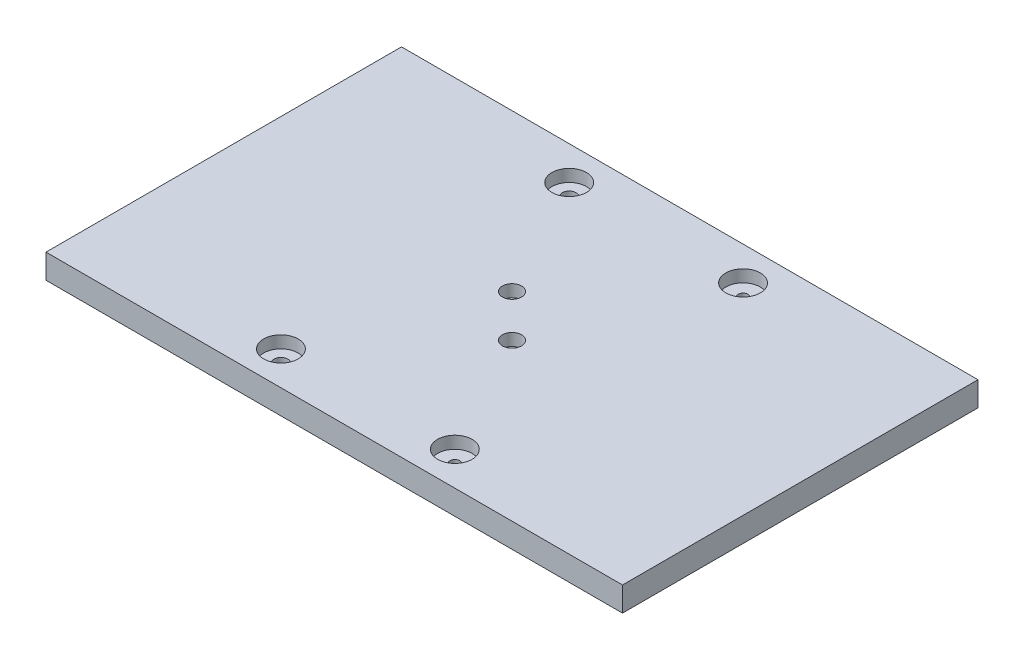
from build123d import *

# Parameters (mm, degrees)
SKETCH1_W           = 300
SKETCH1_H           = 185
SKETCH1_R           = 3.56
SKETCH1_R_2         = 2.5
BOSS_EXTRUDE1_DEPTH = 12.7
CUT_EXTRUDE1_START  = -6.35
SKETCH2_R           = 9
SKETCH2_R_2         = 3.56
SKETCH2_R_3         = 2.5
SKETCH2_R_4         = 5
CUT_EXTRUDE1_DEPTH  = 6.35


with BuildPart() as part:
    # Sketch1 → Boss-Extrude1 (new body)
    with BuildSketch(Plane(origin=(0, 0, 0), x_dir=(1, 0, 0), z_dir=(0, 1, 0))):
        Rectangle(SKETCH1_W, SKETCH1_H)
        with Locations(Location((-45.25, 75, 0), (0, 0, 270))):
            Circle(SKETCH1_R, mode=Mode.SUBTRACT)
        with Locations(Location((-45.25, -75, 0), (0, 0, 270))):
            Circle(SKETCH1_R, mode=Mode.SUBTRACT)
        with Locations(Location((45.25, 75, 0), (0, 0, 270))):
            Circle(SKETCH1_R_2, mode=Mode.SUBTRACT)
        with Locations(Location((45.25, -75, 0), (0, 0, 270))):
            Circle(SKETCH1_R_2, mode=Mode.SUBTRACT)
        with Locations(Location((-11, 11, 0), (0, 0, 270))):
            Circle(SKETCH1_R_2, mode=Mode.SUBTRACT)
        with Locations(Location((11, -11, 0), (0, 0, 270))):
            Circle(SKETCH1_R_2, mode=Mode.SUBTRACT)
    extrude(amount=BOSS_EXTRUDE1_DEPTH)

    # Sketch2 → Cut-Extrude1 (cut)
    # profile 1 of 6: a face of its own
    with BuildSketch(Plane(origin=(0, 12.7, 0), x_dir=(1, 0, 0), z_dir=(0, 1, 0)).offset(CUT_EXTRUDE1_START)):
        with Locations(Location((-45.25, 75, 0), (0, 0, 270))):
            Circle(SKETCH2_R)
        with Locations(Location((-45.25, 75, 0), (0, 0, 270))):
            Circle(SKETCH2_R_2, mode=Mode.SUBTRACT)
    # profile 2 of 6: a face of its own
    with BuildSketch(Plane(origin=(0, 12.7, 0), x_dir=(1, 0, 0), z_dir=(0, 1, 0)).offset(CUT_EXTRUDE1_START)):
        with Locations(Location((45.25, 75, 0), (0, 0, 270))):
            Circle(SKETCH2_R)
        with Locations(Location((45.25, 75, 0), (0, 0, 270))):
            Circle(SKETCH2_R_3, mode=Mode.SUBTRACT)
    # profile 3 of 6: a face of its own
    with BuildSketch(Plane(origin=(0, 12.7, 0), x_dir=(1, 0, 0), z_dir=(0, 1, 0)).offset(CUT_EXTRUDE1_START)):
        with Locations(Location((45.25, -75, 0), (0, 0, 90))):
            Circle(SKETCH2_R)
        with Locations(Location((45.25, -75, 0), (0, 0, 90))):
            Circle(SKETCH2_R_3, mode=Mode.SUBTRACT)
    # profile 4 of 6: a face of its own
    with BuildSketch(Plane(origin=(0, 12.7, 0), x_dir=(1, 0, 0), z_dir=(0, 1, 0)).offset(CUT_EXTRUDE1_START)):
        with Locations(Location((-45.25, -75, 0), (0, 0, 270))):
            Circle(SKETCH2_R)
        with Locations(Location((-45.25, -75, 0), (0, 0, 270))):
            Circle(SKETCH2_R_2, mode=Mode.SUBTRACT)
    # profile 5 of 6: a face of its own
    with BuildSketch(Plane(origin=(0, 12.7, 0), x_dir=(1, 0, 0), z_dir=(0, 1, 0)).offset(CUT_EXTRUDE1_START)):
        with Locations(Location((-11, 11, 0), (0, 0, 270))):
            Circle(SKETCH2_R_4)
        with Locations(Location((-11, 11, 0), (0, 0, 270))):
            Circle(SKETCH2_R_3, mode=Mode.SUBTRACT)
    # profile 6 of 6: a face of its own
    with BuildSketch(Plane(origin=(0, 12.7, 0), x_dir=(1, 0, 0), z_dir=(0, 1, 0)).offset(CUT_EXTRUDE1_START)):
        with Locations(Location((11, -11, 0), (0, 0, 270))):
            Circle(SKETCH2_R_4)
        with Locations(Location((11, -11, 0), (0, 0, 270))):
            Circle(SKETCH2_R_3, mode=Mode.SUBTRACT)
    extrude(amount=CUT_EXTRUDE1_DEPTH, mode=Mode.SUBTRACT)


solid = part.part
